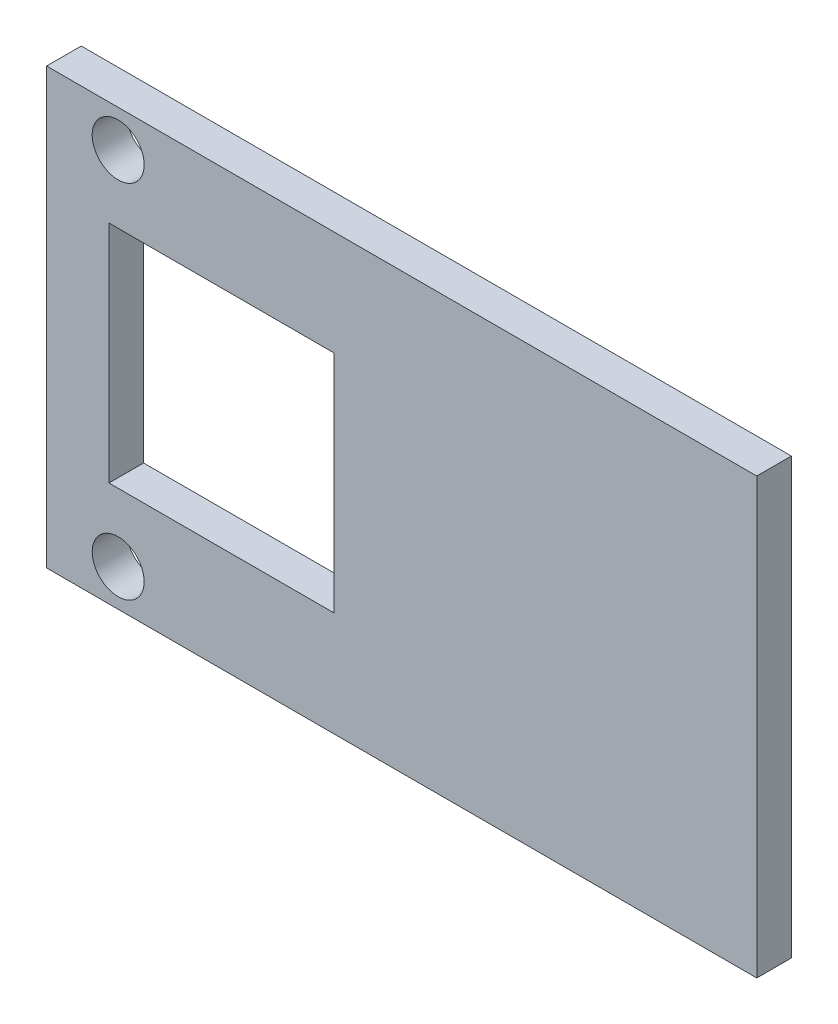
from build123d import *

# Parameters (mm, degrees)
ESBO_O1_W                = 35
ESBO_O1_H                = 25.1
RESSALTO_EXTRUS_O1_DEPTH = 2
ESBO_O2_R                = 1.5
CORTE_EXTRUS_O1_DEPTH    = 2
ESBO_O3_W                = 2.002857319
ESBO_O3_H                = 25.1
RESSALTO_EXTRUS_O2_DEPTH = 2
CORTE_EXTRUS_O2_DEPTH    = 2
ESBO_O5_W                = 4
ESBO_O5_H                = 25.1
RESSALTO_EXTRUS_O3_DEPTH = 2


with BuildPart() as part:
    # Esboço1 → Ressalto-extrusão1 (new body)
    with BuildSketch(Plane.XY):
        with Locations((17.5, 12.55)):
            Rectangle(ESBO_O1_W, ESBO_O1_H)
    extrude(amount=RESSALTO_EXTRUS_O1_DEPTH)

    # Esboço2 → Corte-extrusão1 (cut)
    with BuildSketch(Plane.XY.offset(2)):
        with Locations((2.13, 22.97)):
            Circle(ESBO_O2_R)
        with Locations(Location((2.13, 2.13, 0), (0, 0, 180))):
            Circle(ESBO_O2_R)
    extrude(amount=-CORTE_EXTRUS_O1_DEPTH, mode=Mode.SUBTRACT)

    # Esboço3 → Ressalto-extrusão2 (add)
    with BuildSketch(Plane.XY.offset(2)):
        with Locations((-1.00142866, 12.55)):
            Rectangle(ESBO_O3_W, ESBO_O3_H)
    extrude(amount=-RESSALTO_EXTRUS_O2_DEPTH)

    # Esboço4 → Corte-extrusão2 (cut)
    with BuildSketch(Plane.XY.offset(2)):
        Polygon((1.597142681, 12.55), (1.597142681, 19.05), (14.597142681, 19.05), (14.597142681, 6.05), (1.597142681, 6.05), align=None)
    extrude(amount=-CORTE_EXTRUS_O2_DEPTH, mode=Mode.SUBTRACT)

    # Esboço5 → Ressalto-extrusão3 (add)
    with BuildSketch(Plane.XY.offset(2)):
        with Locations((37, 12.55)):
            Rectangle(ESBO_O5_W, ESBO_O5_H)
    extrude(amount=-RESSALTO_EXTRUS_O3_DEPTH)


solid = part.part
